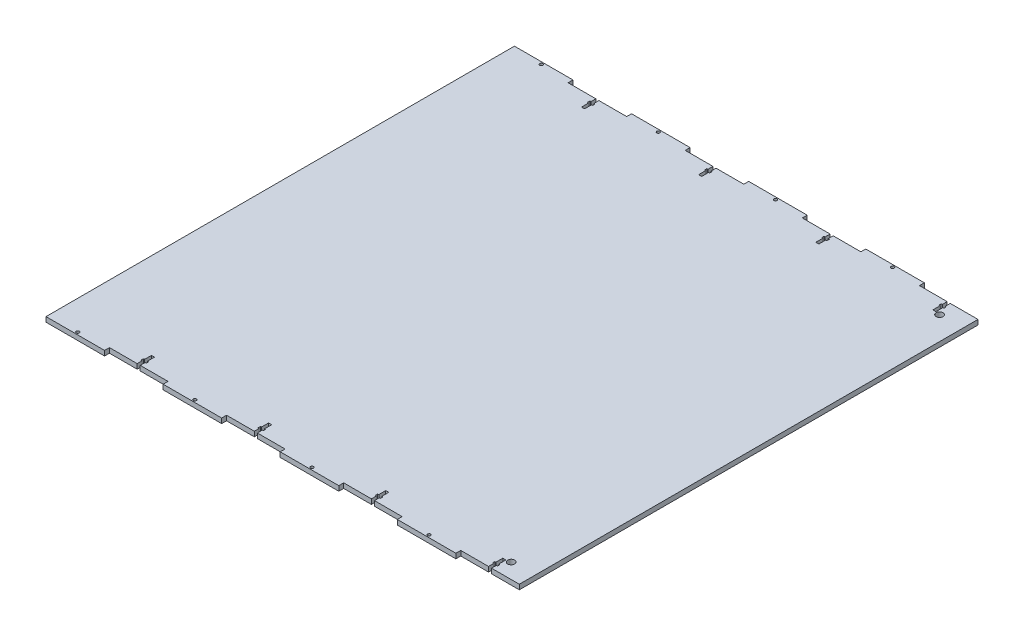
from build123d import *

# Parameters (mm, degrees)
SKETCH1_W           = 609.6
SKETCH1_H           = 304.8
BOSS_EXTRUDE1_DEPTH = 3.175
SKETCH2_R           = 2
SKETCH2_R_2         = 4.5
CUT_EXTRUDE1_DEPTH  = 432.099063441


with BuildPart() as part:
    # Sketch1 → Boss-Extrude1 (new, symmetric)
    with BuildSketch(Plane(origin=(0, 0, 0), x_dir=(1, 0, 0), z_dir=(0, 1, 0))):
        with Locations((0, -152.4)):
            Rectangle(SKETCH1_W, SKETCH1_H)
    boss_extrude1 = extrude(amount=BOSS_EXTRUDE1_DEPTH, both=True)

    # Sketch2 → Cut-Extrude1 (cut, symmetric)
    with BuildSketch(Plane(origin=(0, 3.175, 0), x_dir=(1, 0, 0), z_dir=(0, 1, 0))):
        with Locations(Location((-266.7, -301.625, 0), (0, 0, 270))):
            Circle(SKETCH2_R)
        Polygon((-228.6, -298.45), (-228.6, -304.8), (-152.4, -304.8), (-152.4, -298.45), (-188.5, -298.45), (-192.5, -298.45), align=None)
        Polygon((-192.5, -292.05), (-192.5, -298.45), (-188.5, -298.45), (-188.5, -292.05), (-187.11, -292.05), (-187.11, -288.85), (-188.5, -288.85), (-188.5, -279.8), (-192.5, -279.8), (-192.5, -288.85), (-193.89, -288.85), (-193.89, -292.05), align=None)
        with Locations(Location((-114.3, -301.625, 0), (0, 0, 270))):
            Circle(SKETCH2_R)
        Polygon((-76.2, -298.45), (-76.2, -304.8), (0, -304.8), (0, -298.45), (-36.1, -298.45), (-40.1, -298.45), align=None)
        Polygon((-40.1, -292.05), (-40.1, -298.45), (-36.1, -298.45), (-36.1, -292.05), (-34.71, -292.05), (-34.71, -288.85), (-36.1, -288.85), (-36.1, -279.8), (-40.1, -279.8), (-40.1, -288.85), (-41.49, -288.85), (-41.49, -292.05), align=None)
        with Locations(Location((38.1, -301.625, 0), (0, 0, 270))):
            Circle(SKETCH2_R)
        Polygon((76.2, -298.45), (76.2, -304.8), (152.4, -304.8), (152.4, -298.45), (116.3, -298.45), (112.3, -298.45), align=None)
        Polygon((112.3, -292.05), (112.3, -298.45), (116.3, -298.45), (116.3, -292.05), (117.69, -292.05), (117.69, -288.85), (116.3, -288.85), (116.3, -279.8), (112.3, -279.8), (112.3, -288.85), (110.91, -288.85), (110.91, -292.05), align=None)
        with Locations(Location((190.5, -301.625, 0), (0, 0, 270))):
            Circle(SKETCH2_R)
        Polygon((228.6, -298.45), (228.6, -304.8), (304.8, -304.8), (304.8, -298.45), (268.7, -298.45), (264.7, -298.45), align=None)
        Polygon((264.7, -292.05), (264.7, -298.45), (268.7, -298.45), (268.7, -292.05), (270.09, -292.05), (270.09, -288.85), (268.7, -288.85), (268.7, -279.8), (264.7, -279.8), (264.7, -288.85), (263.31, -288.85), (263.31, -292.05), align=None)
        with Locations(Location((274.46, -278.775, 0), (0, 0, 270))):
            Circle(SKETCH2_R_2)
    cut_extrude1 = extrude(amount=CUT_EXTRUDE1_DEPTH, both=True, mode=Mode.SUBTRACT)

    # Mirror1: Boss-Extrude1, Cut-Extrude1 across plane
    add(boss_extrude1.mirror(Plane(origin=(0, 3.175, 0), x_dir=(1, 0, 0), z_dir=(0, 0, -1))))
    add(cut_extrude1.mirror(Plane(origin=(0, 3.175, 0), x_dir=(1, 0, 0), z_dir=(0, 0, -1))), mode=Mode.SUBTRACT)


solid = part.part
